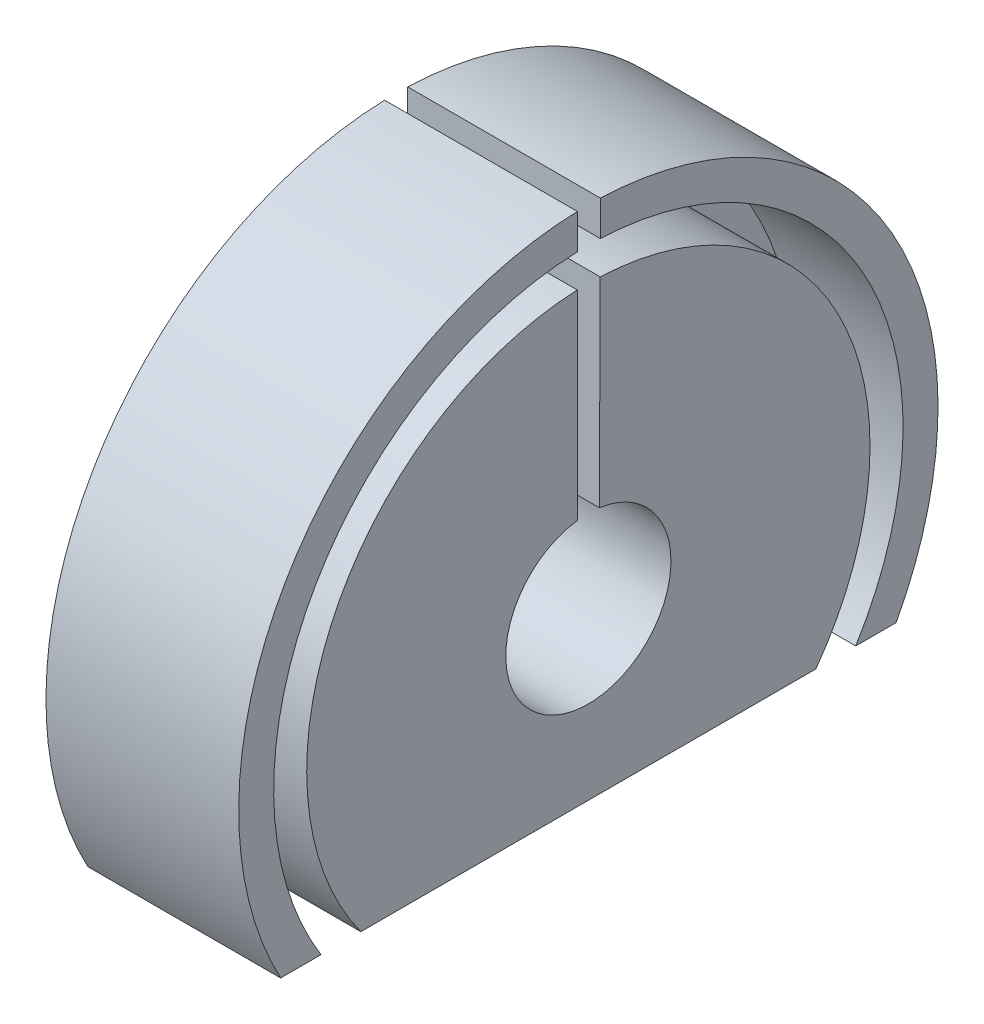
from build123d import *

# Parameters (mm, degrees)
SALIENTE_EXTRUIR1_DEPTH = 35
SALIENTE_EXTRUIR2_DEPTH = 12
CROQUIS2_R              = 57.15
CROQUIS2_R_2            = 51.15
CORTAR_EXTRUIR2_DEPTH   = 20
CORTAR_EXTRUIR3_REACH   = 98.382
CROQUIS4_W              = 151.714378115
CROQUIS4_H              = 39.157803324


with BuildPart() as part:
    # Croquis1 → Saliente-Extruir1 (new body)
    with BuildSketch(Plane(origin=(0, 0, 0), x_dir=(0, 0, -1), z_dir=(1, 0, 0))):
        with BuildLine():
            Line((-2, 14.866068747), (-2, 63.468496122))
            ThreePointArc((-2, 63.468496122), (-0.098669817, -63.499923341), (2.197231834, 63.461974223))
            Line((2.197231834, 63.461974223), (2, 14.866068747))
            ThreePointArc((2, 14.866068747), (0, -15), (-2, 14.866068747))
        make_face()
    extrude(amount=SALIENTE_EXTRUIR1_DEPTH)

    # Croquis3 → Saliente-Extruir2 (add)
    with BuildSketch(Plane.ZY):
        with BuildLine():
            Line((-2.1172783, 19.887612541), (-2.1172783, 43.76224174))
            Line((-2.1172783, 43.76224174), (-12.9131853, 43.76224174))
            Line((-12.9131853, 43.76224174), (-12.9131853, 27.07858278))
            ThreePointArc((-12.9131853, 27.07858278), (0, -30), (12.9131853, 27.07858278))
            Line((12.9131853, 27.07858278), (12.9131853, 43.76224174))
            Line((12.9131853, 43.76224174), (2, 43.76224174))
            Line((2, 43.76224174), (2, 19.899748742))
            ThreePointArc((2, 19.899748742), (0.058952284, -19.999913116), (-2.1172783, 19.887612541))
        make_face()
    extrude(amount=SALIENTE_EXTRUIR2_DEPTH)

    # Croquis2 → Cortar-Extruir2 (cut)
    with BuildSketch(Plane.ZY.offset(-35)):
        Circle(CROQUIS2_R)
        Circle(CROQUIS2_R_2, mode=Mode.SUBTRACT)
    extrude(amount=CORTAR_EXTRUIR2_DEPTH, mode=Mode.SUBTRACT)

    # Croquis4 → Cortar-Extruir3 (cut, up to next)
    with BuildSketch(Plane.ZY, mode=Mode.PRIVATE) as cortar_extruir3_sk1:
        with Locations((-1.340233023, -49.726897526)):
            Rectangle(CROQUIS4_W, CROQUIS4_H)
    cortar_extruir3_tool1 = extrude(cortar_extruir3_sk1.sketch, amount=-CORTAR_EXTRUIR3_REACH, mode=Mode.PRIVATE) & part.part
    add(cortar_extruir3_tool1.solids().sort_by_distance((0, -49.726898, -1.340233))[0], mode=Mode.SUBTRACT)


solid = part.part
